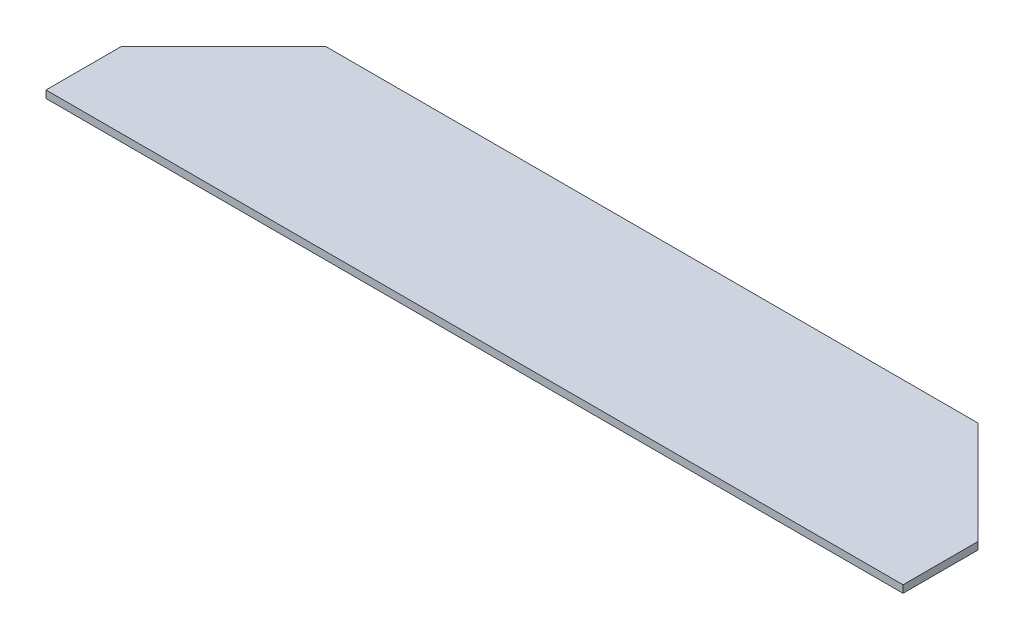
from build123d import *

# Parameters (mm, degrees)
SKETCH1_W           = 1371.6
SKETCH1_H           = 284.1244
BOSS_EXTRUDE1_DEPTH = 11.8872
CUT_EXTRUDE1_DEPTH  = 701.460287377


with BuildPart() as part:
    # Sketch1 → Boss-Extrude1 (new body)
    with BuildSketch(Plane(origin=(0, 0, 0), x_dir=(1, 0, 0), z_dir=(0, 1, 0))):
        Rectangle(SKETCH1_W, SKETCH1_H)
    extrude(amount=BOSS_EXTRUDE1_DEPTH)

    # Sketch3 → Cut-Extrude1 (cut, through all)
    with BuildSketch(Plane(origin=(0, 11.8872, 0), x_dir=(1, 0, 0), z_dir=(0, 1, 0))):
        Polygon((-685.8, -22.0622), (-521.6756, 142.0622), (-685.8, 142.0622), align=None)
        Polygon((685.8, 142.0622), (685.8, -22.0622), (521.6756, 142.0622), align=None)
    extrude(amount=-CUT_EXTRUDE1_DEPTH, mode=Mode.SUBTRACT)


solid = part.part
